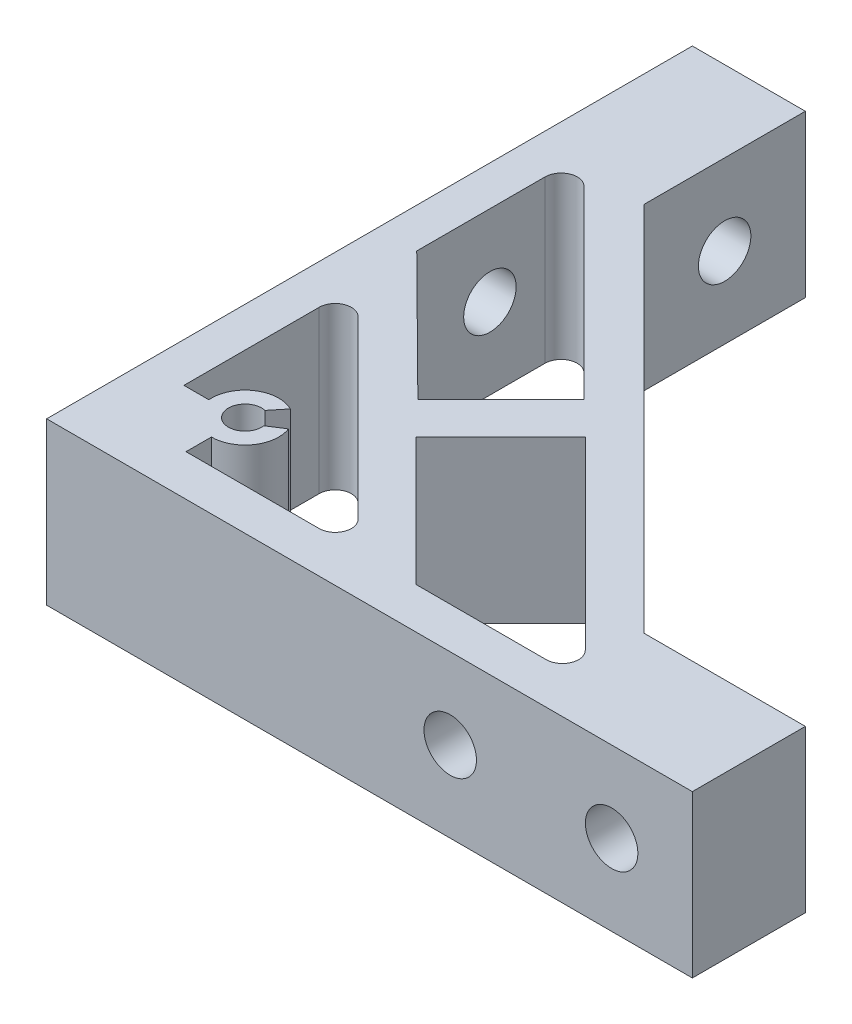
from build123d import *

# Parameters (mm, degrees)
EXTRUDE_1_DEPTH     = 20
SKETCH_2_R          = 3.25
CUT_EXTRUDE_1_DEPTH = 115.891252931
SKETCH_3_R          = 3.25
CUT_EXTRUDE_2_DEPTH = 115.891252931
CUT_EXTRUDE_3_DEPTH = 115.891252931
SKETCH_7_R          = 5.5
CUT_EXTRUDE_4_DEPTH = 25
SKETCH_8_R          = 5.5
CUT_EXTRUDE_5_DEPTH = 25


with BuildPart() as part:
    # 草图1 → 凸台-拉伸1 (new body)
    with BuildSketch(Plane(origin=(0, 0, 0), x_dir=(1, 0, 0), z_dir=(0, 1, 0))):
        Polygon((0, 80), (0, 0), (80, 0), (80, 14), (60, 14), (14, 60), (14, 80), align=None)
    extrude(amount=EXTRUDE_1_DEPTH)

    # 草图2 → 切除-拉伸1 (cut, through all)
    with BuildSketch(Plane.ZY):
        with Locations((-70, 10)):
            Circle(SKETCH_2_R)
        with Locations((-50, 10)):
            Circle(SKETCH_2_R)
    extrude(amount=-CUT_EXTRUDE_1_DEPTH, mode=Mode.SUBTRACT)

    # 草图3 → 切除-拉伸2 (cut, through all)
    with BuildSketch(Plane.XY):
        with Locations((70, 10)):
            Circle(SKETCH_3_R)
        with Locations((50, 10)):
            Circle(SKETCH_3_R)
    extrude(amount=-CUT_EXTRUDE_2_DEPTH, mode=Mode.SUBTRACT)

    # 草图4 → 切除-拉伸3 (cut, through all)
    with BuildSketch(Plane.XZ):
        with BuildLine():
            Line((20.901080392, -25.090385961), (31.191934333, -35.381239902))
            Line((31.191934333, -35.381239902), (8.330781791, -58.242392444))
            ThreePointArc((8.330781791, -58.242392444), (6.151201363, -58.675937947), (4.916568228, -56.828178882))
            Line((4.916568228, -56.828178882), (4.916568228, -40.934892559))
            Line((4.916568228, -40.934892559), (20.901080392, -25.090385961))
        make_face()
        with BuildLine():
            Line((24.837924499, -20.930281625), (35.319025282, -31.411382408))
            Line((35.319025282, -31.411382408), (58.210769263, -8.519638426))
            ThreePointArc((58.210769263, -8.519638426), (58.644314766, -6.340057999), (56.796555701, -5.105424864))
            Line((56.796555701, -5.105424864), (40.662781261, -5.105424864))
            Line((40.662781261, -5.105424864), (24.837924499, -20.930281625))
        make_face()
        with BuildLine():
            Line((12.160826912, -5.105424864), (28.651360093, -5.105424864))
            ThreePointArc((28.651360093, -5.105424864), (30.499119158, -6.340057999), (30.065573655, -8.519638426))
            Line((30.065573655, -8.519638426), (8.330781791, -30.254430291))
            ThreePointArc((8.330781791, -30.254430291), (6.151201363, -30.687975793), (4.916568228, -28.840216728))
            Line((4.916568228, -28.840216728), (4.916568228, -12.090508469))
            Line((4.916568228, -12.090508469), (8.000520281, -12.090508469))
            ThreePointArc((8.000520281, -12.090508469), (9.82829842, -15.883616127), (14.030107382, -16.154245149))
            Line((14.030107382, -16.154245149), (12.625484958, -14.430268904))
            ThreePointArc((12.625484958, -14.430268904), (10.638085741, -11.03439689), (14.202657003, -12.700390319))
            Line((14.202657003, -12.700390319), (16.06551283, -13.896467584))
            ThreePointArc((16.06551283, -13.896467584), (15.593703645, -10.049139087), (12.160826912, -8.249167474))
            Line((12.160826912, -8.249167474), (12.160826912, -5.105424864))
        make_face()
    extrude(amount=-CUT_EXTRUDE_3_DEPTH, mode=Mode.SUBTRACT)

    # 草图7 → 切除-拉伸4 (cut)
    with BuildSketch(Plane.XY.offset(-35)):
        with Locations(Location((50, 10, 0), (0, 0, 180))):
            Circle(SKETCH_7_R)
    extrude(amount=CUT_EXTRUDE_4_DEPTH, mode=Mode.SUBTRACT)

    # 草图8 → 切除-拉伸5 (cut)
    with BuildSketch(Plane(origin=(35, 0, 0), x_dir=(0, 0, -1), z_dir=(1, 0, 0))):
        with Locations(Location((50, 10, 0), (0, 0, 180))):
            Circle(SKETCH_8_R)
    extrude(amount=-CUT_EXTRUDE_5_DEPTH, mode=Mode.SUBTRACT)


solid = part.part
